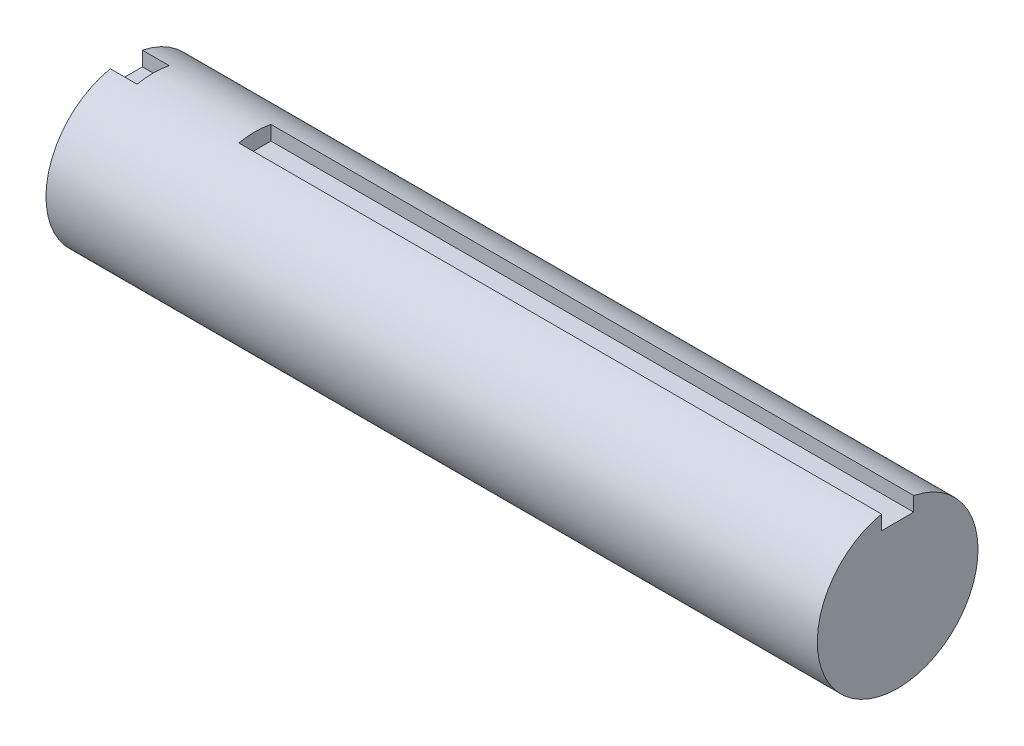
from build123d import *

# Parameters (mm, degrees)
SKETCH1_R           = 38.1
BOSS_EXTRUDE1_DEPTH = 365.76
SKETCH2_W           = 15.24
SKETCH2_H           = 15.24
CUT_EXTRUDE1_DEPTH  = 304.8
SKETCH3_W           = 15.24
SKETCH3_H           = 15.24
CUT_EXTRUDE2_DEPTH  = 12.7


with BuildPart() as part:
    # Sketch1 → Boss-Extrude1 (new body)
    with BuildSketch(Plane(origin=(0, 0, 0), x_dir=(0, 0, -1), z_dir=(1, 0, 0))):
        Circle(SKETCH1_R)
    extrude(amount=BOSS_EXTRUDE1_DEPTH)

    # Sketch2 → Cut-Extrude1 (cut)
    with BuildSketch(Plane(origin=(365.76, 0, 0), x_dir=(0, 0, -1), z_dir=(1, 0, 0))):
        with Locations((0, 38.1)):
            Rectangle(SKETCH2_W, SKETCH2_H)
    extrude(amount=-CUT_EXTRUDE1_DEPTH, mode=Mode.SUBTRACT)

    # Sketch3 → Cut-Extrude2 (cut)
    with BuildSketch(Plane.ZY):
        with Locations((0, 38.1)):
            Rectangle(SKETCH3_W, SKETCH3_H)
    extrude(amount=-CUT_EXTRUDE2_DEPTH, mode=Mode.SUBTRACT)


solid = part.part
